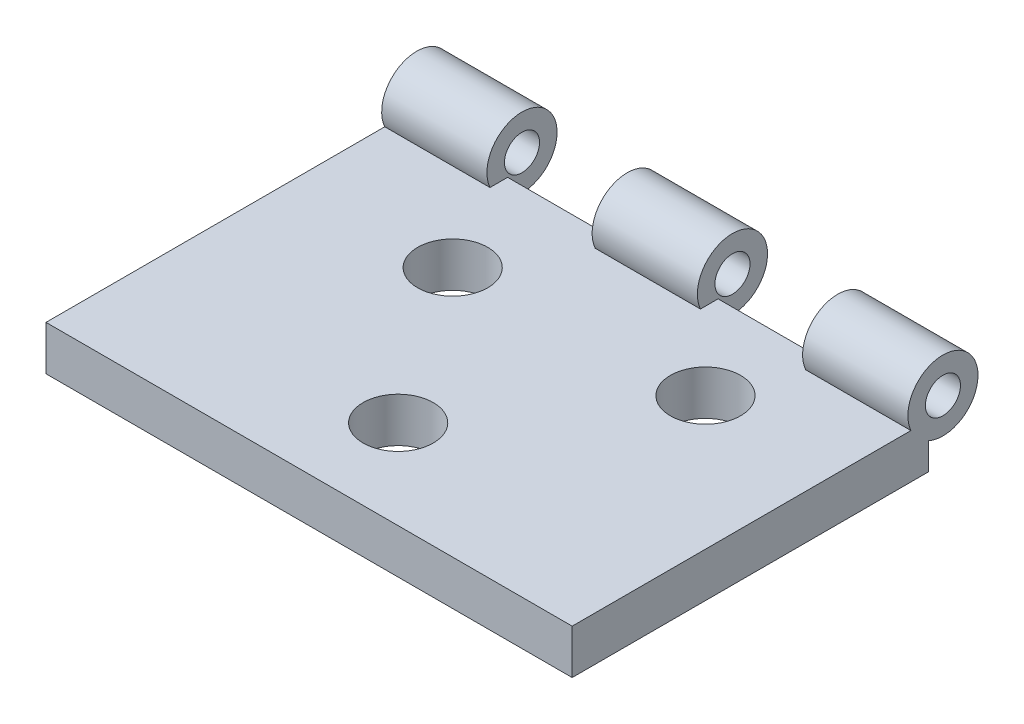
from build123d import *

# Parameters (mm, degrees)
SKETCH1_W           = 75
SKETCH1_H           = 50.8
SKETCH1_R           = 5
BOSS_EXTRUDE1_DEPTH = 6.35
SKETCH2_R           = 5
BOSS_EXTRUDE2_DEPTH = 15
LPATTERN1_COUNT     = 3
LPATTERN1_PITCH     = 30
SKETCH2_4_R         = 2.5
CUT_EXTRUDE2_DEPTH  = 83.80956065


with BuildPart() as part:
    # Sketch1 → Boss-Extrude1 (new body)
    with BuildSketch(Plane(origin=(0, 0, 0), x_dir=(1, 0, 0), z_dir=(0, 1, 0))):
        Rectangle(SKETCH1_W, SKETCH1_H)
        with Locations((0, -12.7)):
            Circle(SKETCH1_R, mode=Mode.SUBTRACT)
        with Locations((-15.279173033, 10.349093201)):
            Circle(SKETCH1_R, mode=Mode.SUBTRACT)
        with Locations((18.543836974, 12.56035891)):
            Circle(SKETCH1_R, mode=Mode.SUBTRACT)
    extrude(amount=BOSS_EXTRUDE1_DEPTH)

    # Sketch2 → Boss-Extrude2 (add)
    with BuildSketch(Plane.ZY.offset(37.5)):
        with Locations((-27.448482339, 8.398482339)):
            Circle(SKETCH2_R)
    boss_extrude2 = extrude(amount=-BOSS_EXTRUDE2_DEPTH)

    # LPattern1: Boss-Extrude2 ×3
    with Locations(*[(i * LPATTERN1_PITCH, 0, 0) for i in range(1, LPATTERN1_COUNT)]):
        add(boss_extrude2)

    # Sketch2<4> → Cut-Extrude2 (cut, through all)
    with BuildSketch(Plane.ZY.offset(37.5)):
        with Locations((-27.448482339, 8.398482339)):
            Circle(SKETCH2_4_R)
    extrude(amount=-CUT_EXTRUDE2_DEPTH, mode=Mode.SUBTRACT)


solid = part.part
